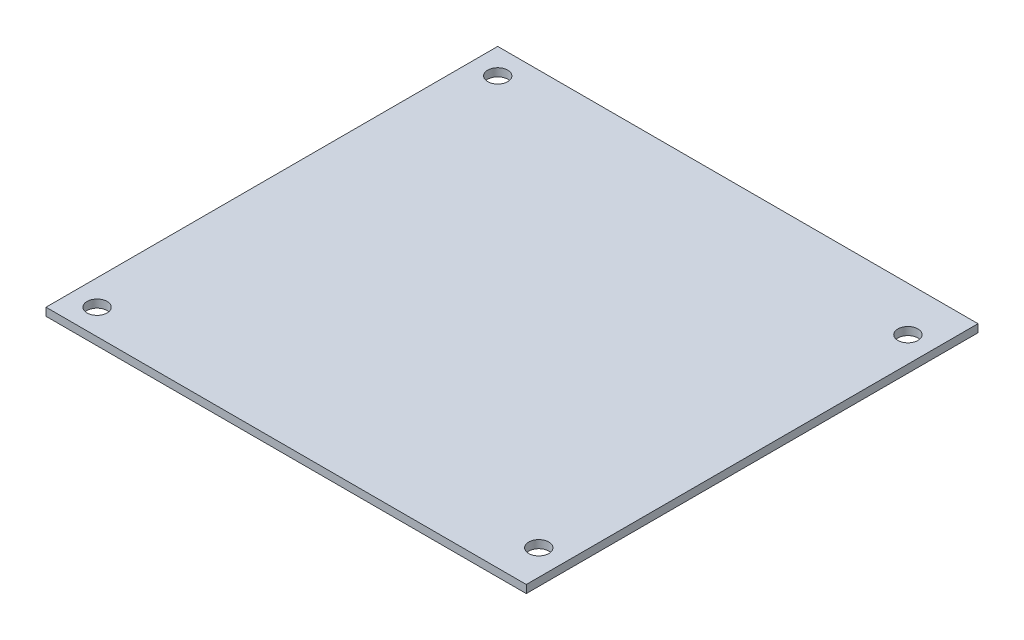
from build123d import *

# Parameters (mm, degrees)
SKETCH1_W           = 95.9
SKETCH1_H           = 90.2
SKETCH1_R           = 2
BOSS_EXTRUDE1_DEPTH = 1.58


with BuildPart() as part:
    # Sketch1 → Boss-Extrude1 (new body)
    with BuildSketch(Plane(origin=(0, 0, 0), x_dir=(1, 0, 0), z_dir=(0, 1, 0))):
        Rectangle(SKETCH1_W, SKETCH1_H)
        with Locations(Location((-42.85, 40, 0), (0, 0, 90))):
            Circle(SKETCH1_R, mode=Mode.SUBTRACT)
        with Locations(Location((42.85, 36.2, 0), (0, 0, 90))):
            Circle(SKETCH1_R, mode=Mode.SUBTRACT)
        with Locations(Location((-42.85, -40, 0), (0, 0, 90))):
            Circle(SKETCH1_R, mode=Mode.SUBTRACT)
        with Locations(Location((42.85, -37.5, 0), (0, 0, 90))):
            Circle(SKETCH1_R, mode=Mode.SUBTRACT)
    extrude(amount=BOSS_EXTRUDE1_DEPTH)


solid = part.part
